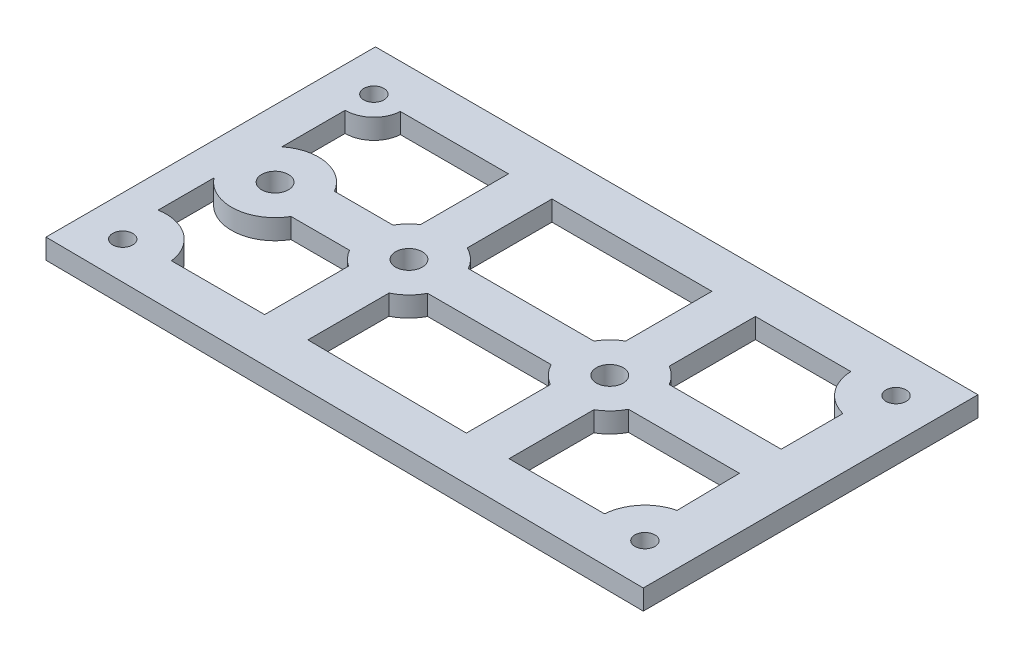
from build123d import *

# Parameters (mm, degrees)
SKETCH1_R           = 2
SKETCH1_R_2         = 1.5
BOSS_EXTRUDE1_DEPTH = 3


with BuildPart() as part:
    # Sketch1 → Boss-Extrude1 (new body)
    with BuildSketch(Plane(origin=(0, 0, 0), x_dir=(1, 0, 0), z_dir=(0, 1, 0))):
        Polygon((-44.676492644, 22.127798429), (-44.676492644, -27.087694748), (45.323507356, -27.872201571), (45.323507356, 22.127798429), align=None)
        with Locations(Location((-14.676492644, -2.872201571, 0), (0, 0, 270))):
            Circle(SKETCH1_R, mode=Mode.SUBTRACT)
        with Locations(Location((-34.676492644, -2.872201571, 0), (0, 0, 270))):
            Circle(SKETCH1_R, mode=Mode.SUBTRACT)
        with Locations(Location((15.323507356, -2.872201571, 0), (0, 0, 270))):
            Circle(SKETCH1_R, mode=Mode.SUBTRACT)
        with Locations(Location((-38.676492644, 15.884701617, 0), (0, 0, 270))):
            Circle(SKETCH1_R_2, mode=Mode.SUBTRACT)
        with Locations(Location((-38.676492644, -21.62910476, 0), (0, 0, 270))):
            Circle(SKETCH1_R_2, mode=Mode.SUBTRACT)
        with Locations(Location((39.323507356, 15.884701617, 0), (0, 0, 270))):
            Circle(SKETCH1_R_2, mode=Mode.SUBTRACT)
        with Locations(Location((39.323507356, -21.62910476, 0), (0, 0, 270))):
            Circle(SKETCH1_R_2, mode=Mode.SUBTRACT)
        with BuildLine():
            Line((-34.460456453, 15.627798429), (-18.317725118, 15.627798429))
            Line((-18.317725118, 15.627798429), (-18.317725118, 2.512167108))
            ThreePointArc((-18.317725118, 2.512167108), (-19.4329567, 1.557928187), (-20.305657768, 0.377798429))
            Line((-20.305657768, 0.377798429), (-29.047327519, 0.377798429))
            ThreePointArc((-29.047327519, 0.377798429), (-33.472098814, 3.51524201), (-38.735588684, 2.204582778))
            Line((-38.735588684, 2.204582778), (-38.735588684, 11.661258938))
            ThreePointArc((-38.735588684, 11.661258938), (-35.803620086, 12.788322495), (-34.460456453, 15.627798429))
        make_face(mode=Mode.SUBTRACT)
        with BuildLine():
            Line((-11.817725118, 15.627798429), (-11.817725118, 2.965387677))
            ThreePointArc((-11.817725118, 2.965387677), (-10.2396971, 1.878045296), (-9.047327519, 0.377798429))
            Line((-9.047327519, 0.377798429), (9.694342232, 0.377798429))
            ThreePointArc((9.694342232, 0.377798429), (10.727313279, 1.723992507), (12.073507356, 2.756963553))
            Line((12.073507356, 2.756963553), (12.073507356, 15.627798429))
            Line((12.073507356, 15.627798429), (-11.817725118, 15.627798429))
        make_face(mode=Mode.SUBTRACT)
        with BuildLine():
            Line((-8.904779675, -5.861738225), (9.550345172, -5.858938653))
            ThreePointArc((9.550345172, -5.858938653), (10.622446791, -7.361080001), (12.073507356, -8.501366696))
            Line((12.073507356, -8.501366696), (12.073507356, -21.048878052))
            Line((12.073507356, -21.048878052), (-11.817725118, -20.833017395))
            Line((-11.817725118, -20.833017395), (-11.817725118, -8.709790819))
            ThreePointArc((-11.817725118, -8.709790819), (-10.132359141, -7.519873108), (-8.904779675, -5.861738225))
        make_face(mode=Mode.SUBTRACT)
        with BuildLine():
            Line((-18.317725118, -8.25657025), (-18.317725118, -20.784452687))
            Line((-18.317725118, -20.784452687), (-32.231606076, -20.784452687))
            ThreePointArc((-32.231606076, -20.784452687), (-34.826040106, -16.392310392), (-39.79198853, -15.225537869))
            Line((-39.79198853, -15.225537869), (-39.79198853, -6.882401296))
            ThreePointArc((-39.79198853, -6.882401296), (-34.217755326, -9.355993677), (-29.047327519, -6.122201571))
            Line((-29.047327519, -6.122201571), (-20.305657768, -6.122201571))
            ThreePointArc((-20.305657768, -6.122201571), (-19.4329567, -7.30233133), (-18.317725118, -8.25657025))
        make_face(mode=Mode.SUBTRACT)
        with BuildLine():
            Line((18.573507356, 15.627798429), (18.573507356, 2.756963553))
            ThreePointArc((18.573507356, 2.756963553), (19.919701434, 1.723992507), (20.952672481, 0.377798429))
            Line((20.952672481, 0.377798429), (37.672865612, 0.377798429))
            Line((37.672865612, 0.377798429), (37.672865612, 9.597780127))
            ThreePointArc((37.672865612, 9.597780127), (34.256177793, 11.81380846), (32.828586206, 15.627798429))
            Line((32.828586206, 15.627798429), (18.573507356, 15.627798429))
        make_face(mode=Mode.SUBTRACT)
        with BuildLine():
            Line((18.573507356, -8.501366696), (18.573423049, -21.172157696))
            Line((18.573423049, -21.172157696), (32.839588836, -21.172157696))
            ThreePointArc((32.839588836, -21.172157696), (34.364481553, -17.426954943), (37.808645365, -15.308092725))
            Line((37.808645365, -15.308092725), (37.669780925, -5.854673043))
            Line((37.669780925, -5.854673043), (21.097575428, -5.857186983))
            ThreePointArc((21.097575428, -5.857186983), (20.025248813, -7.360366817), (18.573507356, -8.501366696))
        make_face(mode=Mode.SUBTRACT)
    extrude(amount=BOSS_EXTRUDE1_DEPTH)


solid = part.part
